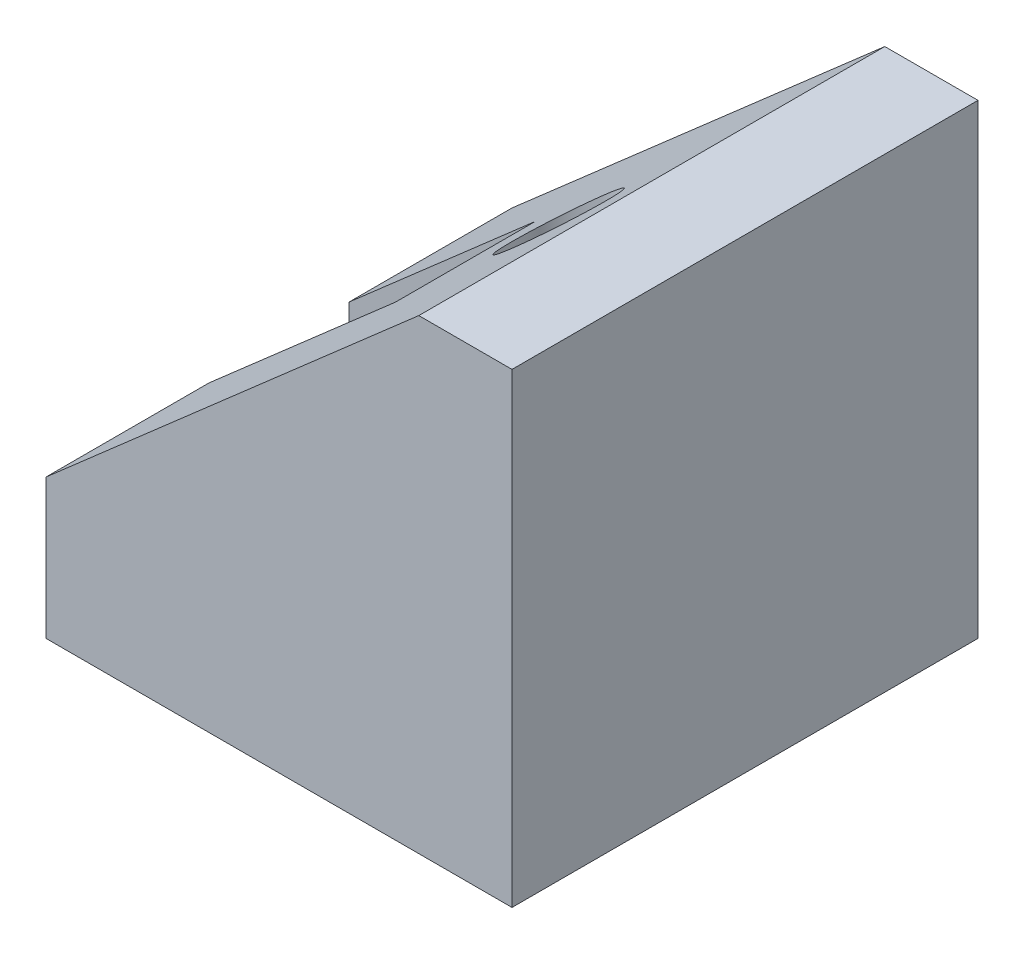
from build123d import *

# Parameters (mm, degrees)
BOSS_EXTRUDE1_DEPTH = 50
SKETCH9_R           = 5
CUT_EXTRUDE1_DEPTH  = 87.602540378
SKETCH12_W          = 20
SKETCH12_H          = 15
CUT_EXTRUDE3_DEPTH  = 87.602540378


with BuildPart() as part:
    # Sketch1 → Boss-Extrude1 (new body)
    with BuildSketch(Plane.XY):
        Polygon((0, 0), (0, 15), (40, 50), (50, 50), (50, 0), align=None)
    extrude(amount=BOSS_EXTRUDE1_DEPTH)

    # Sketch9 → Cut-Extrude1 (cut, through all)
    with BuildSketch(Plane(origin=(0, 0, 0), x_dir=(-1, 0, 0), z_dir=(0, -1, 0))):
        with Locations(Location((-30, -25, 0), (0, 0, 90))):
            Circle(SKETCH9_R)
    extrude(amount=-CUT_EXTRUDE1_DEPTH, mode=Mode.SUBTRACT)

    # Sketch12 → Cut-Extrude3 (cut, through all)
    with BuildSketch(Plane(origin=(0, 0, 0), x_dir=(-1, 0, 0), z_dir=(0, -1, 0))):
        with Locations((-10, -25)):
            Rectangle(SKETCH12_W, SKETCH12_H)
    extrude(amount=-CUT_EXTRUDE3_DEPTH, mode=Mode.SUBTRACT)


solid = part.part
